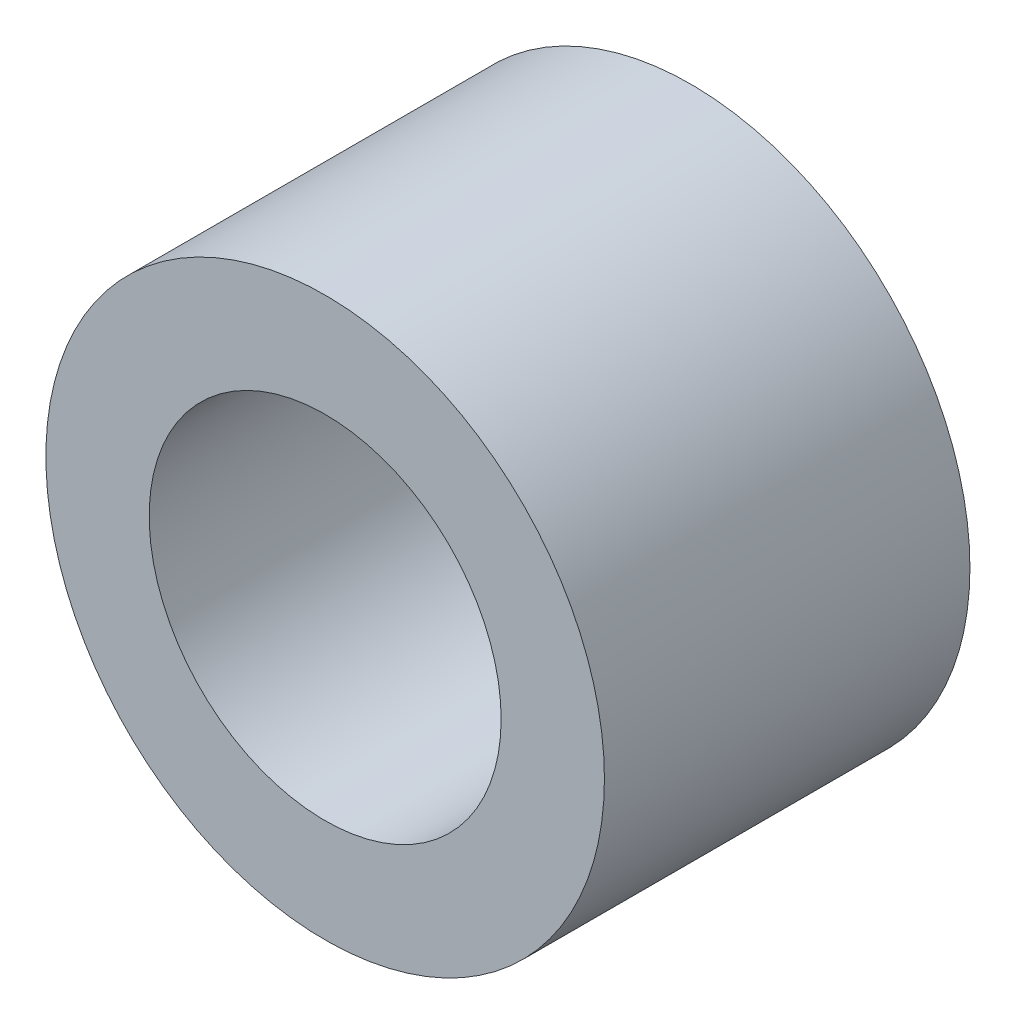
from build123d import *

# Parameters (mm, degrees)
SCHIZZO1_R                   = 4.745
SCHIZZO1_R_2                 = 2.99
ESTRUSIONE_ESTRUSIONE1_DEPTH = 6.21


with BuildPart() as part:
    # Schizzo1 → Estrusione-Estrusione1 (new body)
    with BuildSketch(Plane.XY):
        Circle(SCHIZZO1_R)
        Circle(SCHIZZO1_R_2, mode=Mode.SUBTRACT)
    extrude(amount=ESTRUSIONE_ESTRUSIONE1_DEPTH)


solid = part.part
